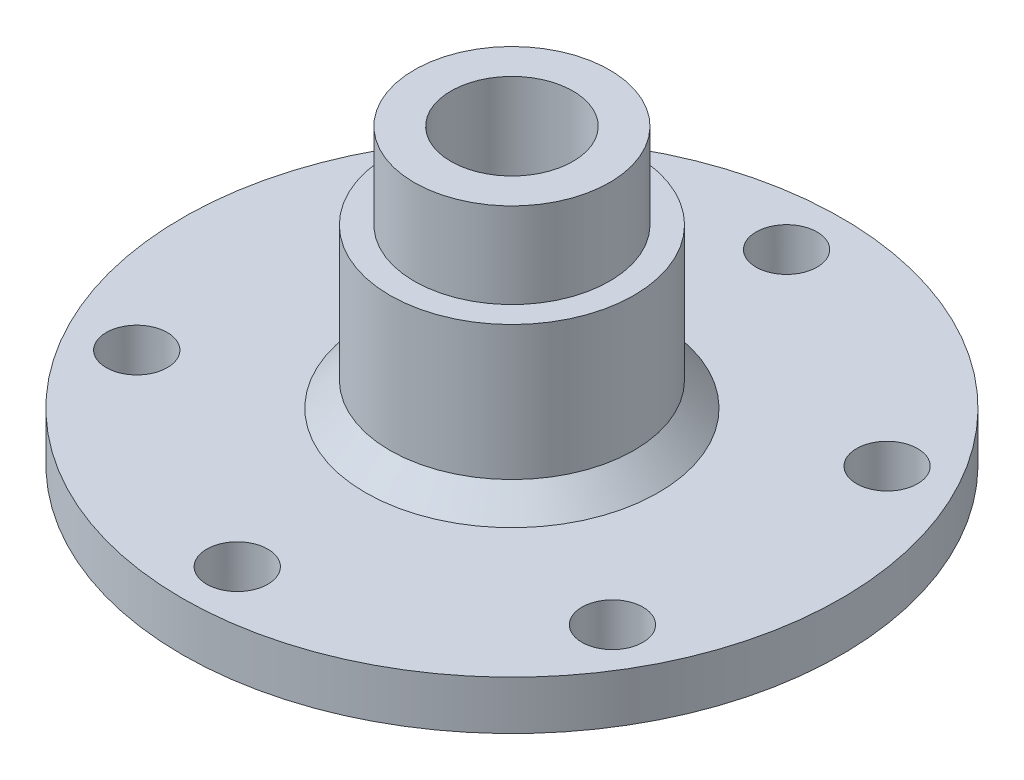
from build123d import *

# Parameters (mm, degrees)
SKETCH_2_R          = 2.5
CUT_EXTRUDE_2_DEPTH = 10
CHAMFER_1_SIZE      = 2
SCALE_1_SCALE       = 0.8
SCALE_2_SCALE       = 0.8
SCALE_3_SCALE       = 0.8


with BuildPart() as part:
    # 草图1 → 旋转1 (revolve)
    with BuildSketch(Plane.XY, mode=Mode.PRIVATE) as revolve_1_sk:
        Polygon((-10, 2), (-27, 2), (-27, 6), (-10, 6), (-10, 19), (-8, 19), (-8, 26), (-5, 26), (-5, 0), (-10, 0), align=None)
    revolve(revolve_1_sk.sketch.rotate(Axis((0, 0, 0), (0, -1, 0)), 270), axis=Axis((0, 0, 0), (0, -1, 0)))

    # 草图2 → 切除-拉伸2 (cut)
    with BuildSketch(Plane.XZ.offset(-2)):
        with Locations(Location((0, 22.5, 0), (0, 0, 270))):
            Circle(SKETCH_2_R)
        with Locations(Location((19.485571585, 11.25, 0), (0, 0, 270))):
            Circle(SKETCH_2_R)
        with Locations(Location((19.485571585, -11.25, 0), (0, 0, 270))):
            Circle(SKETCH_2_R)
        with Locations(Location((0, -22.5, 0), (0, 0, 270))):
            Circle(SKETCH_2_R)
        with Locations(Location((-19.485571585, -11.25, 0), (0, 0, 270))):
            Circle(SKETCH_2_R)
        with Locations(Location((-19.485571585, 11.25, 0), (0, 0, 270))):
            Circle(SKETCH_2_R)
    extrude(amount=-CUT_EXTRUDE_2_DEPTH, mode=Mode.SUBTRACT)

    # 倒角1
    chamfer_1_edges = [part.edges().sort_by_distance(p)[0] for p in [
        (0, 6, -10),
    ]]
    chamfer(chamfer_1_edges, length=CHAMFER_1_SIZE)


with BuildPart() as part_1:
    # 缩放比例1: scaled about (0, 0, 0)
    add(part.part.scale(SCALE_1_SCALE))


with BuildPart() as part_2:
    # 缩放比例2: scaled about (0, 0, 0)
    add(part_1.part.scale(SCALE_2_SCALE))


with BuildPart() as part_3:
    # 缩放比例3: scaled about (0, 0, 0)
    add(part_2.part.scale(SCALE_3_SCALE))


solid = part_3.part
